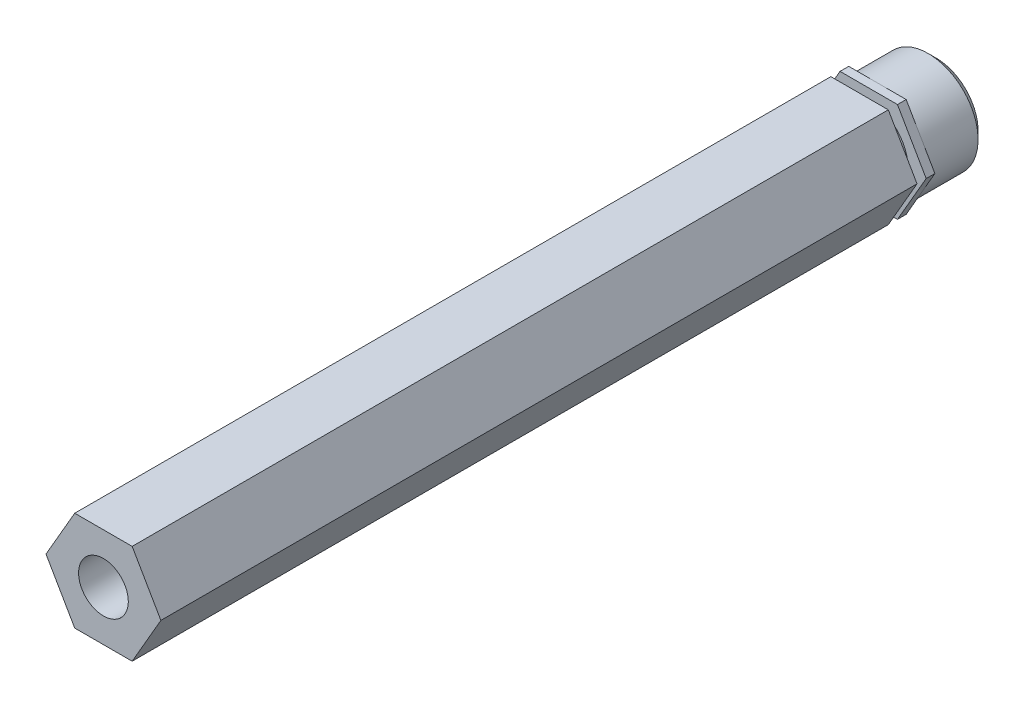
from build123d import *

# Parameters (mm, degrees)
BOSS_EXTRUDE1_DEPTH = 1.1116
SKETCH2_R           = 5.0292
BOSS_EXTRUDE2_DEPTH = 1.1684
BOSS_EXTRUDE3_DEPTH = 96.52
SKETCH4_W           = 6.35
SKETCH4_H           = 7.496
CHAMFER1_SIZE       = 1
SKETCH5_R           = 3.175
CUT_EXTRUDE1_DEPTH  = 9.525


with BuildPart() as part:
    # Sketch1 → Boss-Extrude1 (new body)
    with BuildSketch(Plane(origin=(0, 0, -68.704), x_dir=(-1, 0, 0), z_dir=(0, 0, -1))):
        Polygon((-3.666174209, 6.35), (-7.332348419, 0), (-3.666174209, -6.35), (3.666174209, -6.35), (7.332348419, 0), (3.666174209, 6.35), align=None)
    extrude(amount=-BOSS_EXTRUDE1_DEPTH)

    # Sketch2 → Boss-Extrude2 (add)
    with BuildSketch(Plane.XY.offset(-67.5924)):
        Circle(SKETCH2_R)
    extrude(amount=BOSS_EXTRUDE2_DEPTH)

    # Sketch3 → Boss-Extrude3 (add)
    with BuildSketch(Plane(origin=(0, 0, -66.424), x_dir=(-1, 0, 0), z_dir=(0, 0, -1))):
        Polygon((3.666174209, -6.35), (7.332348419, 0), (3.666174209, 6.35), (-3.666174209, 6.35), (-7.332348419, 0), (-3.666174209, -6.35), align=None)
    extrude(amount=-BOSS_EXTRUDE3_DEPTH)

    # Sketch4 → Revolve1 (revolve)
    with BuildSketch(Plane.XZ, mode=Mode.PRIVATE) as revolve1_sk:
        with Locations((3.175, -72.452)):
            Rectangle(SKETCH4_W, SKETCH4_H)
    revolve(revolve1_sk.sketch.rotate(Axis((0, 0, -68.704), (0, 0, -1)), 180), axis=Axis((0, 0, -68.704), (0, 0, -1)))

    # Chamfer1
    chamfer1_edges = [part.edges().sort_by_distance(p)[0] for p in [
        (6.35, 0, -76.2),
    ]]
    chamfer(chamfer1_edges, length=CHAMFER1_SIZE)

    # Sketch5 → Cut-Extrude1 (cut)
    with BuildSketch(Plane.XY.offset(30.096)):
        Circle(SKETCH5_R)
    extrude(amount=-CUT_EXTRUDE1_DEPTH, mode=Mode.SUBTRACT)


solid = part.part
